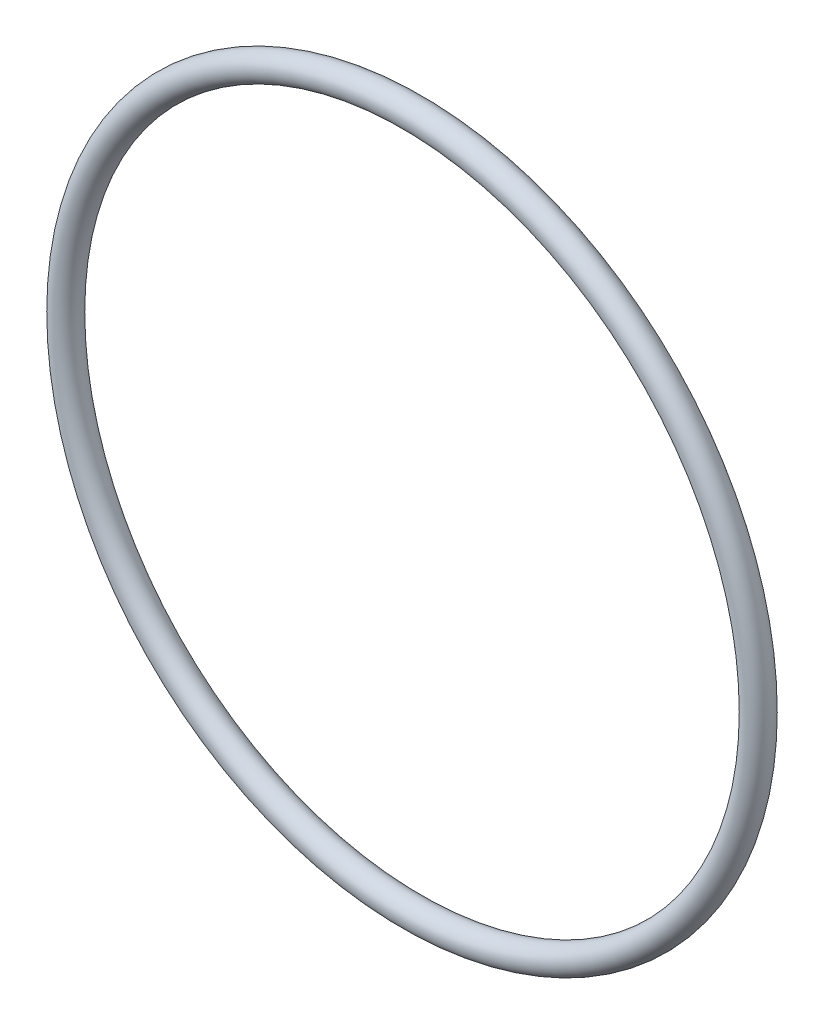
from build123d import *

# Parameters (mm, degrees)
SKETCH1_R = 1.3081


with BuildPart() as part:
    # Sketch1 → Revolve1 (revolve)
    with BuildSketch(Plane(origin=(0, 0, 0), x_dir=(0, -1, 0), z_dir=(1, 0, 0)), mode=Mode.PRIVATE) as revolve1_sk:
        with Locations((33.6931, 0)):
            Circle(SKETCH1_R)
    revolve(revolve1_sk.sketch.rotate(Axis((0, 0, 1.3081), (0, 0, -1)), 270), axis=Axis((0, 0, 1.3081), (0, 0, -1)))


solid = part.part
